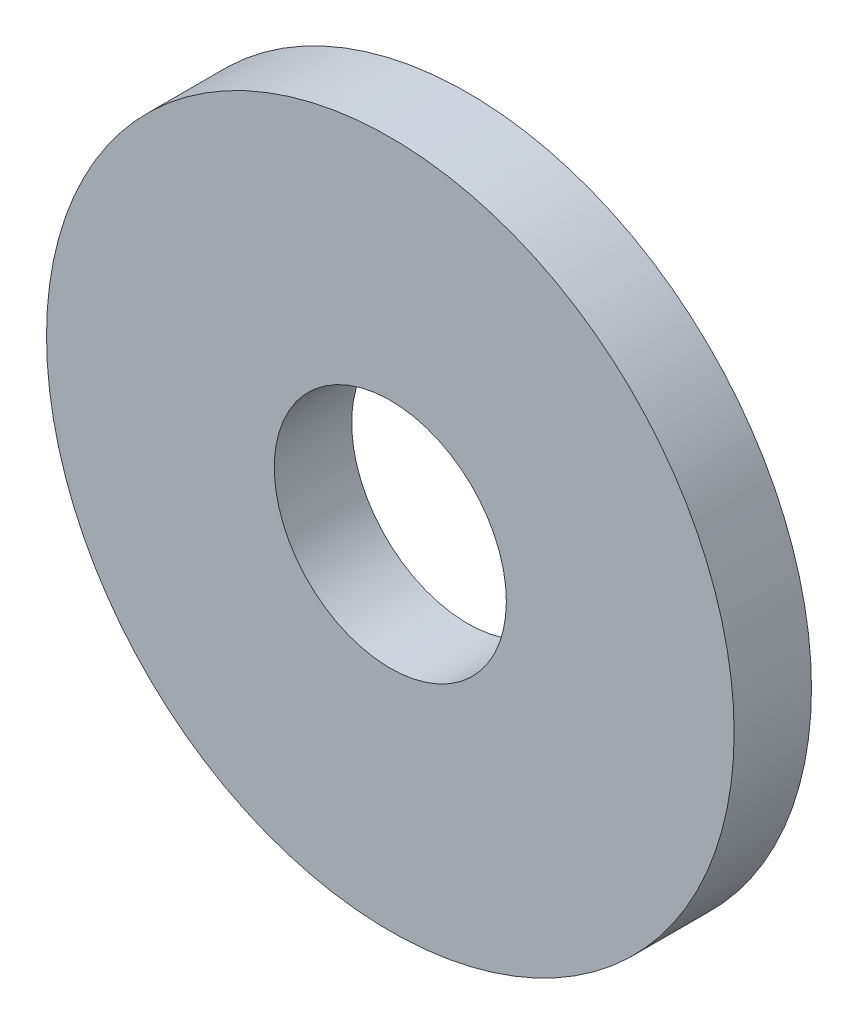
from build123d import *

# Parameters (mm, degrees)
SKETCH1_R           = 4
SKETCH1_R_2         = 1.35
BOSS_EXTRUDE1_DEPTH = 0.9


with BuildPart() as part:
    # Sketch1 → Boss-Extrude1 (new body)
    with BuildSketch(Plane.XY):
        Circle(SKETCH1_R)
        Circle(SKETCH1_R_2, mode=Mode.SUBTRACT)
    extrude(amount=BOSS_EXTRUDE1_DEPTH)


solid = part.part
